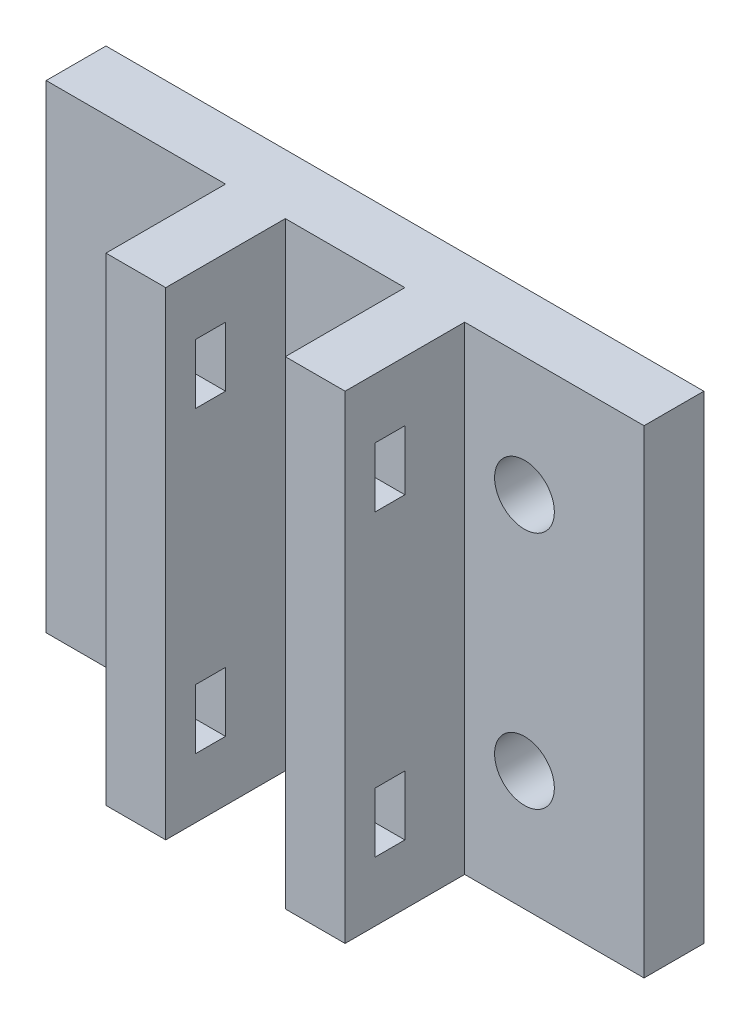
from build123d import *

# Parameters (mm, degrees)
SKETCH1_W           = 50
SKETCH1_H           = 40
BOSS_EXTRUDE1_DEPTH = 10
SKETCH5_W           = 6
SKETCH5_H           = 5
BOSS_EXTRUDE3_DEPTH = 10
SKETCH6_R           = 1.25
CUT_EXTRUDE1_DEPTH  = 20
SKETCH8_W           = 10
SKETCH8_H           = 40
CUT_EXTRUDE2_DEPTH  = 25
SKETCH12_W          = 5
SKETCH12_H          = 5
BOSS_EXTRUDE5_DEPTH = 10
SKETCH13_R          = 1.25
CUT_EXTRUDE4_DEPTH  = 10
SKETCH14_R          = 2.5
CUT_EXTRUDE5_DEPTH  = 10
CUT_EXTRUDE6_DEPTH  = 22
CUT_EXTRUDE7_DEPTH  = 30
CUT_EXTRUDE8_DEPTH  = 30
SCALE1_SCALE        = 2
SKETCH19_W          = 172.616714004
SKETCH19_H          = 129.336721571
SKETCH19_W_2        = 100
SKETCH19_H_2        = 80
CUT_EXTRUDE9_DEPTH  = 20
SKETCH20_W          = 100
SKETCH20_H          = 80
CUT_EXTRUDE10_DEPTH = 10
BOSS_EXTRUDE6_DEPTH = 20
SKETCH22_W          = 5
SKETCH22_H          = 10
CUT_EXTRUDE11_DEPTH = 50


with BuildPart() as part:
    # Sketch1 → Boss-Extrude1 (new body)
    with BuildSketch(Plane(origin=(669.84184187, 0, 0), x_dir=(1, 0, 0), z_dir=(0, 0, 1))):
        with Locations((-671.310344828, 437.637931034)):
            Rectangle(SKETCH1_W, SKETCH1_H)
    boss_extrude1 = extrude(amount=BOSS_EXTRUDE1_DEPTH)

    # Sketch5 → Boss-Extrude3 (add)
    with BuildSketch(Plane(origin=(23.531497042, 0, 0), x_dir=(0, 0, -1), z_dir=(1, 0, 0))):
        with Locations((-5, 442.637931034)):
            Rectangle(SKETCH5_W, SKETCH5_H)
        with Locations((-5, 432.637931034)):
            Rectangle(SKETCH5_W, SKETCH5_H)
    boss_extrude3 = extrude(amount=BOSS_EXTRUDE3_DEPTH)

    # Sketch6 → Cut-Extrude1 (cut)
    with BuildSketch(Plane(origin=(669.84184187, 445.137931034, 0), x_dir=(1, 0, 0), z_dir=(0, 1, 0))):
        with Locations(Location((-641.310344828, -5, 0), (0, 0, 180))):
            Circle(SKETCH6_R)
    cut_extrude1 = extrude(amount=-CUT_EXTRUDE1_DEPTH, mode=Mode.SUBTRACT)

    # Sketch8 → Cut-Extrude2 (cut)
    with BuildSketch(Plane.ZY.offset(26.468502958)):
        with Locations((5, 437.637931034)):
            Rectangle(SKETCH8_W, SKETCH8_H)
    extrude(amount=-CUT_EXTRUDE2_DEPTH, mode=Mode.SUBTRACT)

    # Mirror1: Boss-Extrude1, Boss-Extrude3, Cut-Extrude1 across plane
    add(boss_extrude1.mirror(Plane(origin=(-1.468502958, 0, 0), x_dir=(0, 0, 1), z_dir=(1, 0, 0))))
    add(boss_extrude3.mirror(Plane(origin=(-1.468502958, 0, 0), x_dir=(0, 0, 1), z_dir=(1, 0, 0))))
    add(cut_extrude1.mirror(Plane(origin=(-1.468502958, 0, 0), x_dir=(0, 0, 1), z_dir=(1, 0, 0))), mode=Mode.SUBTRACT)

    # Sketch12 → Boss-Extrude5 (add)
    with BuildSketch(Plane(origin=(0, 457.637931034, 0), x_dir=(1, 0, 0), z_dir=(0, 1, 0))):
        with Locations((-1.468502958, -5)):
            Rectangle(SKETCH12_W, SKETCH12_H)
    extrude(amount=BOSS_EXTRUDE5_DEPTH)

    # Sketch13 → Cut-Extrude4 (cut)
    with BuildSketch(Plane(origin=(1.031497042, 0, 0), x_dir=(0, 0, -1), z_dir=(1, 0, 0))):
        with Locations((-5, 462.637931034)):
            Circle(SKETCH13_R)
    extrude(amount=-CUT_EXTRUDE4_DEPTH, mode=Mode.SUBTRACT)

    # Sketch14 → Cut-Extrude5 (cut)
    with BuildSketch(Plane.XY.offset(10)):
        with Locations((-16.468502958, 447.637931034)):
            Circle(SKETCH14_R)
        with Locations((-16.468502958, 427.637931034)):
            Circle(SKETCH14_R)
        with Locations((13.531497042, 447.637931034)):
            Circle(SKETCH14_R)
        with Locations((13.531497042, 427.637931034)):
            Circle(SKETCH14_R)
    extrude(amount=-CUT_EXTRUDE5_DEPTH, mode=Mode.SUBTRACT)

    # Sketch15 → Cut-Extrude6 (cut)
    with BuildSketch(Plane(origin=(0, 445.137931034, 0), x_dir=(1, 0, 0), z_dir=(0, 1, 0))):
        with BuildLine():
            Line((33.531497042, -2), (28.531497042, -2))
            ThreePointArc((28.531497042, -2), (30.652817386, -2.878679656), (31.531497042, -5))
            ThreePointArc((31.531497042, -5), (30.652817386, -7.121320344), (28.531497042, -8))
            Line((28.531497042, -8), (33.531497042, -8))
            Line((33.531497042, -8), (33.531497042, -2))
        make_face()
    extrude(amount=-CUT_EXTRUDE6_DEPTH, mode=Mode.SUBTRACT)

    # Sketch17 → Cut-Extrude7 (cut)
    with BuildSketch(Plane(origin=(0, 445.137931034, 0), x_dir=(1, 0, 0), z_dir=(0, 1, 0))):
        with BuildLine():
            Line((-36.468502958, -8), (-31.468502958, -8))
            ThreePointArc((-31.468502958, -8), (-34.468502958, -5), (-31.468502958, -2))
            Line((-31.468502958, -2), (-36.468502958, -2))
            Line((-36.468502958, -2), (-36.468502958, -8))
        make_face()
    extrude(amount=-CUT_EXTRUDE7_DEPTH, mode=Mode.SUBTRACT)

    # Sketch18 → Cut-Extrude8 (cut)
    with BuildSketch(Plane(origin=(1.031497042, 0, 0), x_dir=(0, 0, -1), z_dir=(1, 0, 0))):
        with BuildLine():
            Line((-7.5, 467.637931034), (-7.5, 462.637931034))
            ThreePointArc((-7.5, 462.637931034), (-5, 465.137931034), (-2.5, 462.637931034))
            Line((-2.5, 462.637931034), (-2.5, 467.637931034))
            Line((-2.5, 467.637931034), (-7.5, 467.637931034))
        make_face()
    extrude(amount=-CUT_EXTRUDE8_DEPTH, mode=Mode.SUBTRACT)


with BuildPart() as part_1:
    # Scale1: scaled about (-1.468502958, 437.810556227, 5)
    add(part.part.scale(SCALE1_SCALE).moved(Location((1.468502958, -437.810556227, -5))))

    # Sketch19 → Cut-Extrude9 (cut)
    with BuildSketch(Plane.XY.offset(15)):
        with Locations((2.170441993, 437.623617036)):
            Rectangle(SKETCH19_W, SKETCH19_H)
        with Locations((-1.468502958, 437.465305842)):
            Rectangle(SKETCH19_W_2, SKETCH19_H_2, mode=Mode.SUBTRACT)
    extrude(amount=-CUT_EXTRUDE9_DEPTH, mode=Mode.SUBTRACT)

    # Sketch20 → Cut-Extrude10 (cut)
    with BuildSketch(Plane.XY.offset(15)):
        with Locations((-1.468502958, 437.465305842)):
            Rectangle(SKETCH20_W, SKETCH20_H)
    extrude(amount=-CUT_EXTRUDE10_DEPTH, mode=Mode.SUBTRACT)

    # Sketch21 → Boss-Extrude6 (add)
    with BuildSketch(Plane.XY.offset(5)):
        Polygon((-11.468502958, 477.465305842), (-21.468502958, 477.465305842), (-21.468502958, 397.465305842), (-11.468502958, 397.465305842), (-11.468502958, 464.619479755), align=None)
        Polygon((18.531497042, 477.465305842), (8.531497042, 477.465305842), (8.531497042, 471.588870089), (8.531497042, 397.465305842), (18.531497042, 397.465305842), align=None)
    extrude(amount=BOSS_EXTRUDE6_DEPTH)

    # Sketch22 → Cut-Extrude11 (cut)
    with BuildSketch(Plane.ZY.offset(21.468502958)):
        with Locations((17.5, 462.465305842)):
            Rectangle(SKETCH22_W, SKETCH22_H)
        with Locations((17.5, 412.465305842)):
            Rectangle(SKETCH22_W, SKETCH22_H)
    extrude(amount=-CUT_EXTRUDE11_DEPTH, mode=Mode.SUBTRACT)


solid = part_1.part
